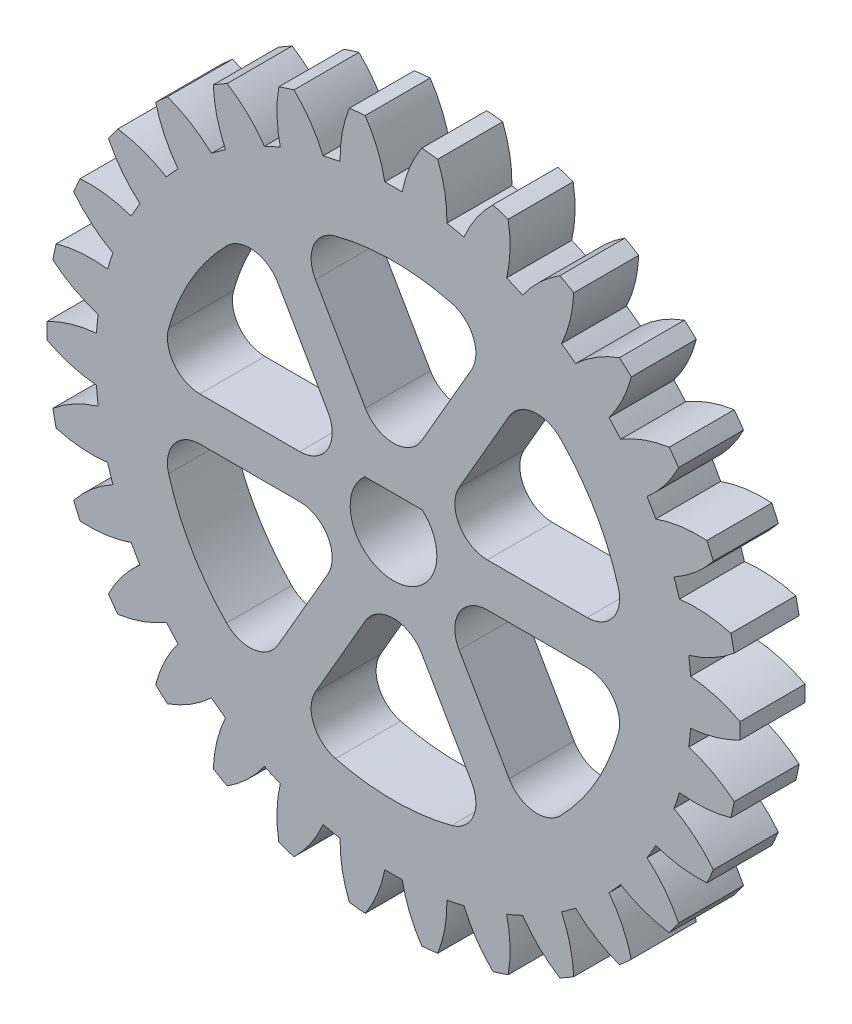
from build123d import *

# Parameters (mm, degrees)
SKETCH1_R                = 16
BOSS_EXTRUDE1_DEPTH      = 3
CUT_EXTRUDE1_START       = -3
CUT_EXTRUDE1_DEPTH       = 3
CIRPATTERN1_COUNT        = 30
CUT_EXTRUDE2_DEPTH       = 23.788067443276493
FILLET2_R                = 1.5
CIRPATTERN3_COUNT        = 6
FILLET2_OF_CIRPATTERN3_R = 1.5
CUT_EXTRUDE3_DEPTH       = 23.788067443276493


with BuildPart() as part:
    # Sketch1 → Boss-Extrude1 (new body)
    with BuildSketch(Plane.XY):
        Circle(SKETCH1_R)
    extrude(amount=BOSS_EXTRUDE1_DEPTH)

    # Sketch2 → Cut-Extrude1 (cut)
    with BuildSketch(Plane.XY.offset(3).offset(CUT_EXTRUDE1_START)):
        with BuildLine():
            ThreePointArc((1.3053666920378888, 15.946661650618852), (0.7429861302204239, 14.89069541110261), (0.4012934400817945, 13.744142882513525))
            ThreePointArc((0.4012934400817945, 13.744142882513525), (8.4e-16, 13.749999999999996), (-0.4012934400817945, 13.744142882513525))
            ThreePointArc((-0.4012934400817945, 13.744142882513525), (-0.7429861302204239, 14.89069541110261), (-1.3053666920378888, 15.946661650618852))
            ThreePointArc((-1.3053666920378888, 15.946661650618852), (9.8e-16, 15.999999999999837), (1.3053666920378888, 15.946661650618852))
        make_face()
    cut_extrude1 = extrude(amount=CUT_EXTRUDE1_DEPTH, mode=Mode.SUBTRACT)

    # CirPattern1: Cut-Extrude1 ×30 about axis
    cirpattern1_axis = Axis((0, 0, 3), (0, 0, 1))
    for i in range(1, CIRPATTERN1_COUNT):
        add(cut_extrude1.rotate(cirpattern1_axis, i * 360 / CIRPATTERN1_COUNT), mode=Mode.SUBTRACT)

    # Sketch3 → Cut-Extrude2 (cut, through all)
    with BuildSketch(Plane.XY.offset(3)):
        with BuildLine():
            Line((4.9e-16, 1.9999999999999996), (4.499999999999984, 9.794228634059955))
            ThreePointArc((4.499999999999984, 9.794228634059955), (6.6e-16, 10.778539536330504), (-4.499999999999984, 9.794228634059955))
            Line((-4.499999999999984, 9.794228634059955), (4.9e-16, 1.9999999999999996))
        make_face()
    cut_extrude2 = extrude(amount=-CUT_EXTRUDE2_DEPTH, mode=Mode.SUBTRACT)

    # Fillet2
    fillet2_edges = [part.edges().sort_by_distance(p)[0] for p in [
        (-4.499999999999984, 9.794228634059955, 1.5),
        (4.9e-16, 1.9999999999999996, 1.5),
        (4.499999999999984, 9.794228634059955, 1.5),
    ]]
    fillet(fillet2_edges, radius=FILLET2_R)

    # CirPattern3: Cut-Extrude2 ×6 about axis
    cirpattern3_axis = Axis((0, 0, 0), (0, 0, 1))
    for i in range(1, CIRPATTERN3_COUNT):
        add(cut_extrude2.rotate(cirpattern3_axis, i * 360 / CIRPATTERN3_COUNT), mode=Mode.SUBTRACT)

    # Fillet2 of CirPattern3
    fillet2_of_cirpattern3_edges = [part.edges().sort_by_distance(p)[0] for p in [
        (-10.732050807568877, 1.0000000000000187, 1.5),
        (-1.7320508075688765, 1.0000000000000004, 1.5),
        (-6.232050807568891, 8.794228634059937, 1.5),
        (-6.232050807568893, -8.794228634059936, 1.5),
        (-1.7320508075688772, -0.9999999999999989, 1.5),
        (-10.732050807568875, -1.0000000000000155, 1.5),
        (4.499999999999983, -9.794228634059955, 1.5),
        (-7.3e-16, -1.9999999999999996, 1.5),
        (-4.499999999999985, -9.794228634059955, 1.5),
        (10.732050807568875, -1.000000000000023, 1.5),
        (1.732050807568876, -1.000000000000001, 1.5),
        (6.2320508075688865, -8.794228634059941, 1.5),
        (6.232050807568891, 8.794228634059937, 1.5),
        (1.732050807568877, 0.9999999999999996, 1.5),
        (10.732050807568877, 1.0000000000000187, 1.5),
    ]]
    fillet(fillet2_of_cirpattern3_edges, radius=FILLET2_OF_CIRPATTERN3_R)

    # Sketch4 → Cut-Extrude3 (cut, through all)
    with BuildSketch(Plane.XY.offset(3)):
        with BuildLine():
            Line((-1.3228756555322951, 1.5000000000000002), (1.3228756555322951, 1.5000000000000002))
            ThreePointArc((1.3228756555322951, 1.5000000000000002), (-3.7e-16, -2), (-1.3228756555322951, 1.5000000000000002))
        make_face()
    extrude(amount=-CUT_EXTRUDE3_DEPTH, mode=Mode.SUBTRACT)


solid = part.part
